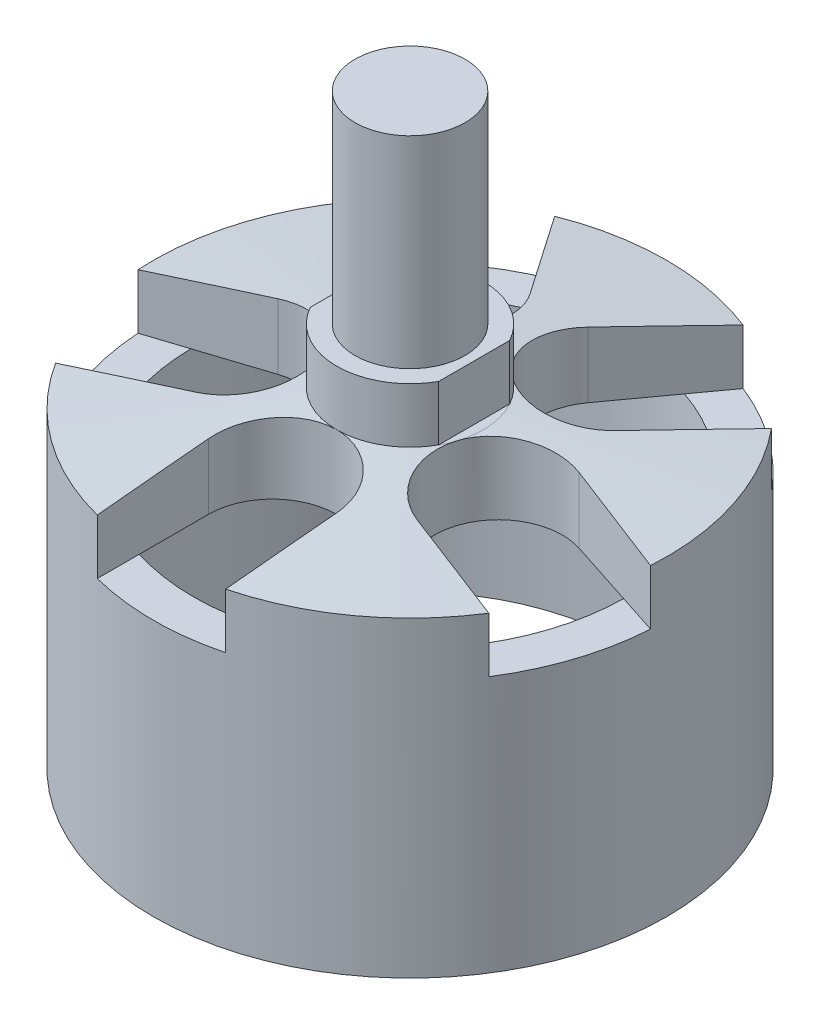
from build123d import *

# Parameters (mm, degrees)
SKETCH_1_R               = 14
SKETCH_1_R_2             = 11.8
EXTRUDE_1_DEPTH          = 14
SKETCH_2_R               = 14
EXTRUDE_2_DEPTH          = 4
CHAMFER_1_SIZE           = 1
CHAMFER_1_SIZE2          = 10
SKETCH_3_R               = 4
EXTRUDE_3_DEPTH          = 3
SKETCH_4_R               = 3
EXTRUDE_4_DEPTH          = 11
SKETCH_5_W               = 6.079740031
SKETCH_5_H               = 11.892824797
SKETCH_5_W_2             = 4.533139496
SKETCH_5_H_2             = 13.012776908
CUT_EXTRUDE_1_DEPTH      = 3
CUT_EXTRUDE_2_DEPTH      = 4
PATTERN_CIRCULAR_1_COUNT = 5


with BuildPart() as part:
    # Эскиз1 → Бобышка-Вытянуть1 (new body)
    with BuildSketch(Plane(origin=(0, 0, 0), x_dir=(1, 0, 0), z_dir=(0, 1, 0))):
        with Locations(Location((0, 0, 0), (0, 0, 270))):
            Circle(SKETCH_1_R)
        with Locations(Location((0, 0, 0), (0, 0, 270))):
            Circle(SKETCH_1_R_2, mode=Mode.SUBTRACT)
    extrude(amount=EXTRUDE_1_DEPTH)

    # Эскиз2 → Бобышка-Вытянуть2 (add)
    with BuildSketch(Plane(origin=(0, 14, 0), x_dir=(1, 0, 0), z_dir=(0, 1, 0))):
        with Locations(Location((0, 0, 0), (0, 0, 270))):
            Circle(SKETCH_2_R)
    extrude(amount=EXTRUDE_2_DEPTH)

    # Фаска1
    chamfer_1_edges = [part.edges().sort_by_distance(p)[0] for p in [
        (0, 18, -14),
    ]]
    chamfer_1_side = [part.faces().sort_by_distance(p)[0] for p in [
        (0, 9, -14),
    ]]
    chamfer(chamfer_1_edges, length=CHAMFER_1_SIZE, length2=CHAMFER_1_SIZE2, reference=chamfer_1_side[0])

    # Эскиз3 → Бобышка-Вытянуть3 (add)
    with BuildSketch(Plane(origin=(0, 18, 0), x_dir=(1, 0, 0), z_dir=(0, 1, 0))):
        with Locations(Location((0, 0, 0), (0, 0, 90))):
            Circle(SKETCH_3_R)
    extrude(amount=EXTRUDE_3_DEPTH)

    # Эскиз4 → Бобышка-Вытянуть4 (add)
    with BuildSketch(Plane(origin=(0, 21, 0), x_dir=(1, 0, 0), z_dir=(0, 1, 0))):
        with Locations(Location((0, 0, 0), (0, 0, 270))):
            Circle(SKETCH_4_R)
    extrude(amount=EXTRUDE_4_DEPTH)

    # Эскиз5 → Вырез-Вытянуть1 (cut)
    with BuildSketch(Plane(origin=(0, 21, 0), x_dir=(1, 0, 0), z_dir=(0, 1, 0))):
        with Locations((-6.539870016, -0.426648424)):
            Rectangle(SKETCH_5_W, SKETCH_5_H)
        with Locations((5.766569748, 0.133327632)):
            Rectangle(SKETCH_5_W_2, SKETCH_5_H_2)
    extrude(amount=-CUT_EXTRUDE_1_DEPTH, mode=Mode.SUBTRACT)

    # Эскиз6 → Вырез-Вытянуть2 (cut)
    with BuildSketch(Plane(origin=(0, 18, 0), x_dir=(1, 0, 0), z_dir=(0, 1, 0))):
        with BuildLine():
            Line((-3.5, -7.5), (-3.5, -15.705995079))
            Line((-3.5, -15.705995079), (3.5, -15.705995079))
            Line((3.5, -15.705995079), (3.5, -7.5))
            ThreePointArc((3.5, -7.5), (0, -4), (-3.5, -7.5))
        make_face()
    cut_extrude_2 = extrude(amount=-CUT_EXTRUDE_2_DEPTH, mode=Mode.SUBTRACT)

    # Круговой массив1: Вырез-Вытянуть2 ×5 about axis
    pattern_circular_1_axis = Axis((0, 0, 0), (0, 1, 0))
    for i in range(1, PATTERN_CIRCULAR_1_COUNT):
        add(cut_extrude_2.rotate(pattern_circular_1_axis, i * 360 / PATTERN_CIRCULAR_1_COUNT), mode=Mode.SUBTRACT)


solid = part.part
